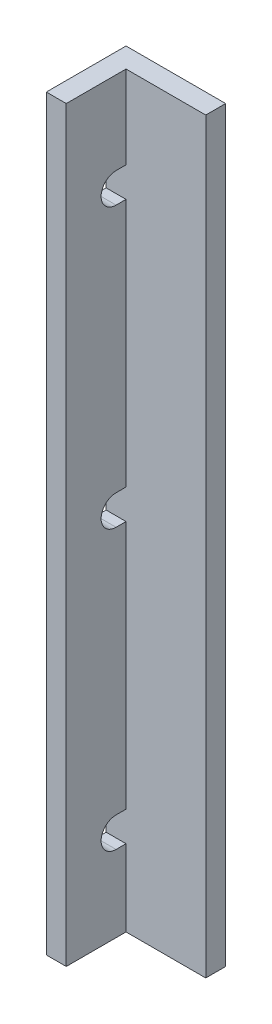
from build123d import *

# Parameters (mm, degrees)
BOSS_EXTRU_1_DEPTH           = 75
ENL_V_MAT_EXTRU_9_DEPTH      = 1
ENL_V_MAT_EXTRU_9_DEPTH_BACK = 3


with BuildPart() as part:
    # Esquisse2 → Boss.-Extru.1 (new body)
    with BuildSketch(Plane(origin=(0, 0, 0), x_dir=(1, 0, 0), z_dir=(0, 1, 0))):
        Polygon((0, 0), (0, 8), (10, 8), (10, 6), (2, 6), (2, 0), align=None)
    extrude(amount=BOSS_EXTRU_1_DEPTH)

    # Esquisse3 → Enlèv. mat.-Extru.9 (cut, two sides: drawn at the far end of the back side and taken through both)
    with BuildSketch(Plane(origin=(2, 0, 0), x_dir=(0, 0, -1), z_dir=(1, 0, 0)).offset(-ENL_V_MAT_EXTRU_9_DEPTH_BACK)):
        with BuildLine():
            Line((6, 38.672788966), (6, 35.672788966))
            Line((6, 35.672788966), (5, 35.672788966))
            ThreePointArc((5, 35.672788966), (3.5, 37.172788966), (5, 38.672788966))
            Line((5, 38.672788966), (6, 38.672788966))
        make_face()
        with BuildLine():
            Line((6, 63.672788966), (5, 63.672788966))
            ThreePointArc((5, 63.672788966), (3.5, 65.172788966), (5, 66.672788966))
            Line((5, 66.672788966), (6, 66.672788966))
            Line((6, 66.672788966), (6, 63.672788966))
        make_face()
        with BuildLine():
            Line((6, 7.672788966), (5, 7.672788966))
            ThreePointArc((5, 7.672788966), (3.5, 9.172788966), (5, 10.672788966))
            Line((5, 10.672788966), (6, 10.672788966))
            Line((6, 10.672788966), (6, 7.672788966))
        make_face()
    extrude(amount=ENL_V_MAT_EXTRU_9_DEPTH + ENL_V_MAT_EXTRU_9_DEPTH_BACK, mode=Mode.SUBTRACT)


solid = part.part
